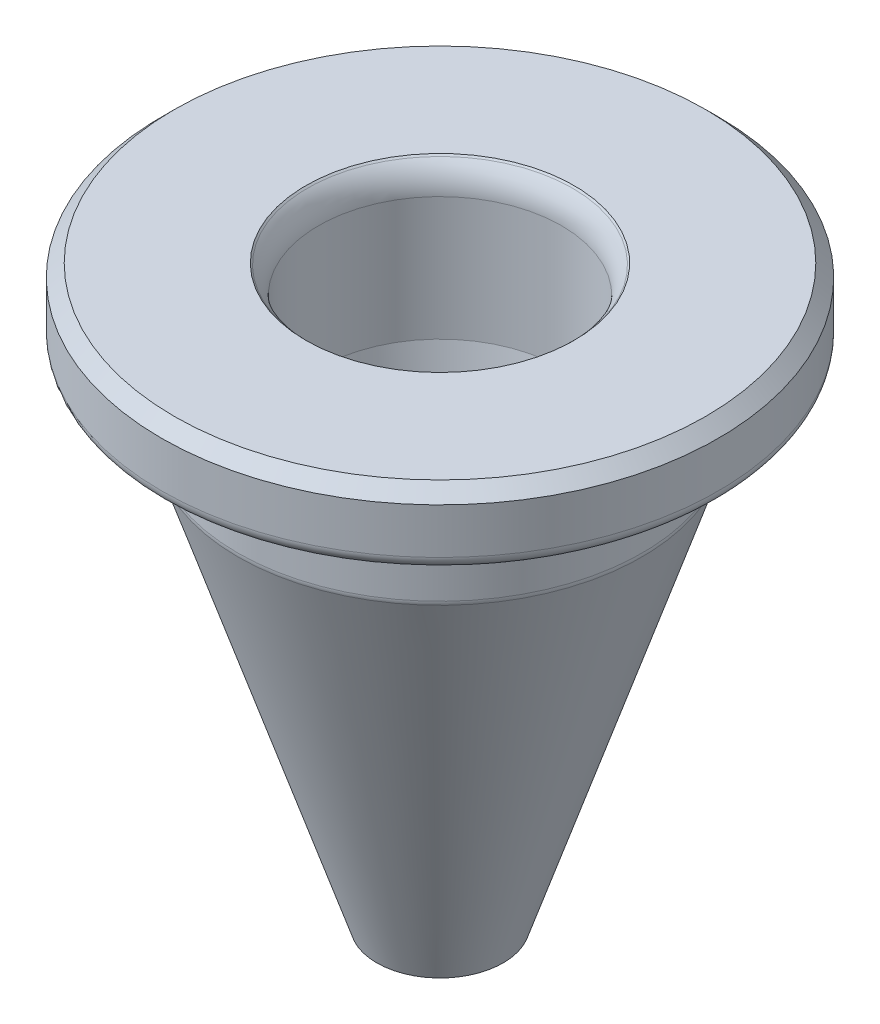
from build123d import *

# Parameters (mm, degrees)
FL_CHE_VERSCHIEBEN1_BY          = 1
AUFSATZ_LINEAR_START            = -2.8
SKIZZE2_R                       = 11
SKIZZE2_R_2                     = 4.8
AUFSATZ_LINEAR_AUSTRAGEN1_DEPTH = 2.8
VERRUNDUNG1_R                   = 0.5
FASE1_SIZE                      = 0.5
VERRUNDUNG2_R                   = 1.5


with BuildPart() as part:
    # Skizze1 → Rotation1 (revolve)
    with BuildSketch(Plane.XY, mode=Mode.PRIVATE) as rotation1_sk:
        Polygon((2, 0), (4.8, 17), (4.8, 22), (8, 22), (8, 17), (2.5, 0.3), align=None)
    revolve(rotation1_sk.sketch.rotate(Axis((0, 0, 0), (0, 1, 0)), 90), axis=Axis((0, 0, 0), (0, 1, 0)))

    # Fläche verschieben1: a face moved outward by 1.0
    extrude(part.faces().sort_by_distance((6.4, 22, 0))[0], amount=FL_CHE_VERSCHIEBEN1_BY, dir=(0, 1, 0))

    # Skizze2 → Aufsatz-Linear austragen1 (add)
    with BuildSketch(Plane(origin=(0, 23, 0), x_dir=(1, 0, 0), z_dir=(0, 1, 0)).offset(AUFSATZ_LINEAR_START)):
        with Locations(Location((0, 0, 0), (0, 0, 270))):
            Circle(SKIZZE2_R)
        with Locations(Location((0, 0, 0), (0, 0, 90))):
            Circle(SKIZZE2_R_2, mode=Mode.SUBTRACT)
    extrude(amount=AUFSATZ_LINEAR_AUSTRAGEN1_DEPTH)

    # Verrundung1
    verrundung1_edges = [part.edges().sort_by_distance(p)[0] for p in [
        (0, 20.2, 8),
        (0, 20.2, -11),
        (0, 17, 8),
    ]]
    fillet(verrundung1_edges, radius=VERRUNDUNG1_R)

    # Fase1
    fase1_edges = [part.edges().sort_by_distance(p)[0] for p in [
        (0, 23, -11),
        (0, 23, 4.8),
    ]]
    chamfer(fase1_edges, length=FASE1_SIZE)

    # Verrundung2
    verrundung2_edges = [part.edges().sort_by_distance(p)[0] for p in [
        (0, 22.5, 4.8),
    ]]
    fillet(verrundung2_edges, radius=VERRUNDUNG2_R)


solid = part.part
